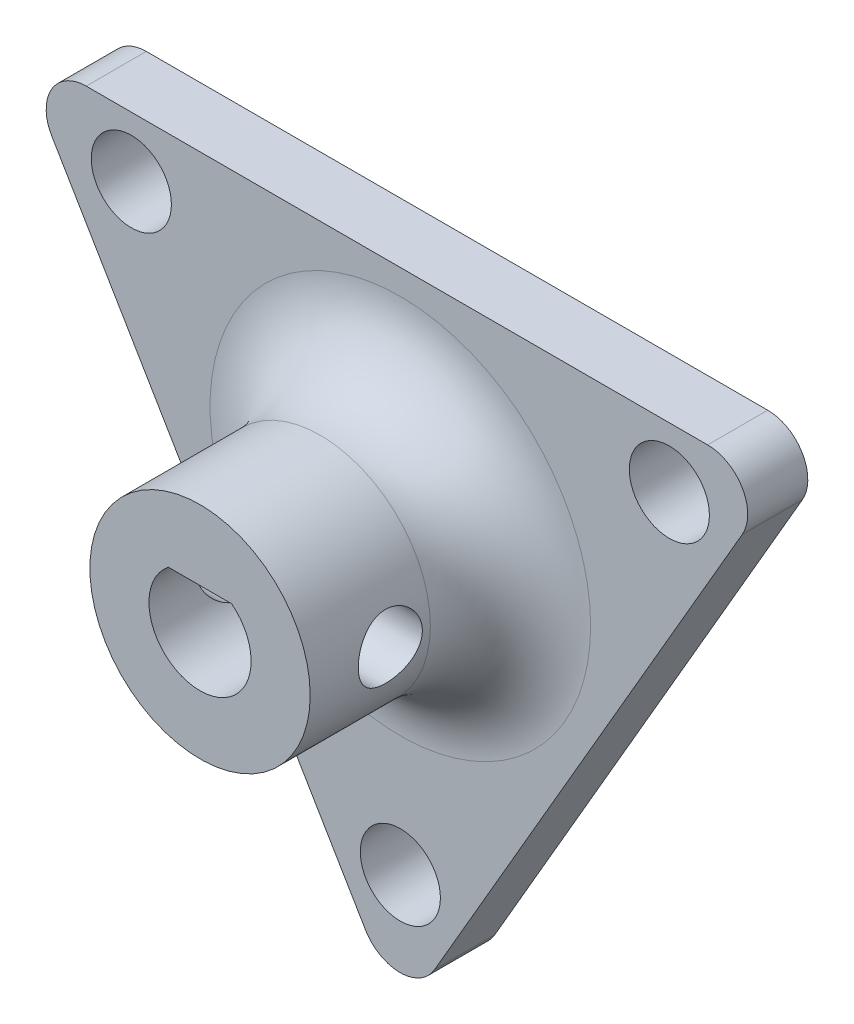
from build123d import *

# Parameters (mm, degrees)
SKETCH1_R               = 2.000000038
SKETCH1_R_2             = 1.999999864
SKETCH1_R_3             = 1.999999855
BOSS_EXTRUDE1_DEPTH     = 3
SKETCH2_R               = 5.5
BOSS_EXTRUDE2_DEPTH     = 10
CUT_EXTRUDE1_DEPTH      = 30.235355095
CUT_EXTRUDE1_DEPTH_BACK = 30.235355095
FILLET1_R               = 2
FILLET2_R               = 4
CUT_EXTRUDE2_DEPTH      = 28.078088376
CUT_EXTRUDE2_DEPTH_BACK = 28.078088376
SKETCH4_R               = 1.6


with BuildPart() as part:
    # Sketch1 → Boss-Extrude1 (new body)
    with BuildSketch(Plane.XY):
        Polygon((-19.186339187, 14.630551858), (18.813660813, 14.630551858), (1.3e-07, -17.821065516), align=None)
        with Locations((-13.429805086, 11.630551858)):
            Circle(SKETCH1_R, mode=Mode.SUBTRACT)
        with Locations((13.429804917, 11.630551858)):
            Circle(SKETCH1_R_2, mode=Mode.SUBTRACT)
        with Locations((8.5e-08, -11.630551858)):
            Circle(SKETCH1_R_3, mode=Mode.SUBTRACT)
    extrude(amount=BOSS_EXTRUDE1_DEPTH)

    # Sketch2 → Boss-Extrude2 (add)
    with BuildSketch(Plane.XY.offset(3)):
        with Locations((0, 3.880551858)):
            Circle(SKETCH2_R)
    extrude(amount=BOSS_EXTRUDE2_DEPTH)

    # Sketch3 → Cut-Extrude1 (cut, two sides: drawn at the far end of the back side and taken through both)
    with BuildSketch(Plane.XY.offset(13).offset(-CUT_EXTRUDE1_DEPTH_BACK)):
        with BuildLine():
            Line((-1.581929202, 5.880551858), (1.581929202, 5.880551858))
            ThreePointArc((1.581929202, 5.880551858), (0, 1.330551858), (-1.581929202, 5.880551858))
        make_face()
    extrude(amount=CUT_EXTRUDE1_DEPTH + CUT_EXTRUDE1_DEPTH_BACK, mode=Mode.SUBTRACT)

    # Fillet1
    fillet1_edges = [part.edges().sort_by_distance(p)[0] for p in [
        (-19.186339187, 14.630551858, 1.5),
        (18.813660813, 14.630551858, 1.5),
        (1.3e-07, -17.821065516, 1.5),
    ]]
    fillet(fillet1_edges, radius=FILLET1_R)

    # Fillet2
    fillet2_edges = [part.edges().sort_by_distance(p)[0] for p in [
        (-5.5, 3.880551858, 3),
    ]]
    fillet(fillet2_edges, radius=FILLET2_R)

    # Sketch4 → Cut-Extrude2 (cut, two sides: drawn at the far end of the back side and taken through both)
    with BuildSketch(Plane(origin=(0, 0, 0), x_dir=(0, 0, -1), z_dir=(1, 0, 0)).offset(-CUT_EXTRUDE2_DEPTH_BACK)):
        with Locations((-9, 3.880551858)):
            Circle(SKETCH4_R)
    extrude(amount=CUT_EXTRUDE2_DEPTH + CUT_EXTRUDE2_DEPTH_BACK, mode=Mode.SUBTRACT)


solid = part.part
